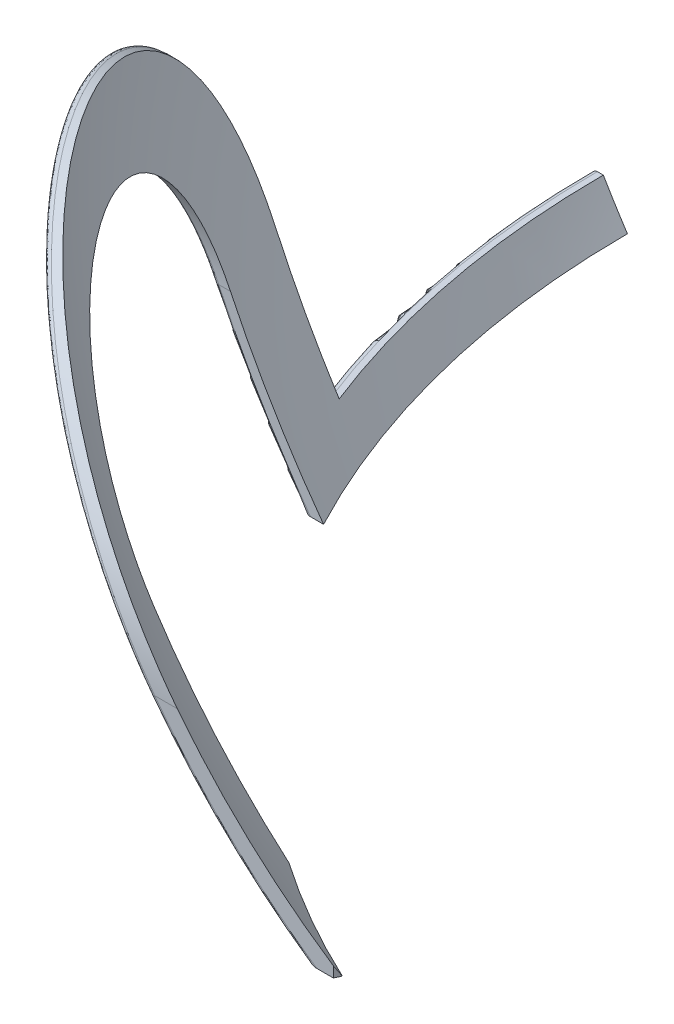
from build123d import *

# Parameters (mm, degrees)
REVOLVE1_ANGLE     = 130
SKETCH2_W          = 99.06
SKETCH2_H          = 9.525
CUT_EXTRUDE1_DEPTH = 340.527915992
FILLET1_R          = 1.27


with BuildPart() as part:
    # Sketch1 → Revolve1 (revolve, symmetric)
    with BuildSketch(Plane.XY) as revolve1_sk:
        with BuildLine():
            Line((-194.945, -11.795080514), (-198.72613444, -11.795080514))
            ThreePointArc((-198.72613444, -11.795080514), (-221.981484738, 33.976287639), (-235.681647174, 83.454919486))
            Line((-235.681647174, 83.454919486), (-232.45953717, 83.454919486))
            ThreePointArc((-232.45953717, 83.454919486), (-218.550660927, 33.920363635), (-194.945, -11.795080514))
        make_face()
    revolve(axis=Axis((17.78, 127, 0), (0, 1, 0)), revolution_arc=REVOLVE1_ANGLE / 2)
    revolve(revolve1_sk.sketch, axis=Axis((17.78, 127, 0), (0, -1, 0)), revolution_arc=REVOLVE1_ANGLE / 2)

    # Sketch2 → Cut-Extrude1 (cut, through all)
    with BuildSketch(Plane(origin=(0, 0, 0), x_dir=(0, 0, -1), z_dir=(1, 0, 0))):
        with BuildLine():
            Line((194.31, 26.304919486), (194.31, -11.795080514))
            Line((194.31, -11.795080514), (196.221195584, -11.795080514))
            add(Edge.make_bspline(
                [(196.221195584, -11.795080514), (221.715706378, 32.084968528), (229.714264549, 83.454919486)],
                knots=[4.142318737, 4.142318737, 4.142318737, 4.542248488, 4.542248488, 4.542248488], degree=2, weights=[1, 0.980073555, 1]))
            Line((229.714264549, 83.454919486), (137.160000039, 83.454919486))
            ThreePointArc((137.160000039, 83.454919486), (177.571152559, 66.716072016), (194.31, 26.304919486))
        make_face()
        with BuildLine():
            Line((0, -2.270080514), (80.01, -2.270080514))
            Line((80.01, -2.270080514), (80.01, 26.304919486))
            ThreePointArc((80.01, 26.304919486), (96.748847469, 66.716072044), (137.160000039, 83.454919486))
            Line((137.160000039, 83.454919486), (0, 83.454919486))
            Line((0, 83.454919486), (0, -2.270080514))
        make_face()
        with BuildLine():
            Line((-99.06, -2.270080514), (0, -2.270080514))
            Line((0, -2.270080514), (0, 83.454919486))
            Line((0, 83.454919486), (-229.714264549, 83.454919486))
            add(Edge.make_bspline(
                [(-229.714264549, 83.454919486), (-221.715706378, 32.084968528), (-196.221195584, -11.795080514)],
                knots=[1.740936819, 1.740936819, 1.740936819, 2.14086657, 2.14086657, 2.14086657], degree=2, weights=[1, 0.980073555, 1]))
            Line((-196.221195584, -11.795080514), (-175.26, -11.795080514))
            Line((-175.26, -11.795080514), (-175.26, 26.304919486))
            ThreePointArc((-175.26, 26.304919486), (-137.16, 64.404919486), (-99.06, 26.304919486))
            Line((-99.06, 26.304919486), (-99.06, -2.270080514))
        make_face()
        with Locations((-49.53, -7.032580514)):
            Rectangle(SKETCH2_W, SKETCH2_H)
        with BuildLine():
            Line((-175.26, -11.795080514), (-99.06, -11.795080514))
            Line((-99.06, -11.795080514), (-99.06, -2.270080514))
            Line((-99.06, -2.270080514), (-99.06, 26.304919486))
            ThreePointArc((-99.06, 26.304919486), (-137.16, 64.404919486), (-175.26, 26.304919486))
            Line((-175.26, 26.304919486), (-175.26, -11.795080514))
        make_face()
        with BuildLine():
            ThreePointArc((175.26, 26.304919486), (137.16, 64.404919486), (99.06, 26.304919486))
            Line((99.06, 26.304919486), (99.06, -11.795080514))
            Line((99.06, -11.795080514), (175.26, -11.795080514))
            Line((175.26, -11.795080514), (175.26, 26.304919486))
        make_face()
    extrude(amount=-CUT_EXTRUDE1_DEPTH, mode=Mode.SUBTRACT)

    # Fillet1
    fillet1_edges = [part.edges().sort_by_distance(p)[0] for p in [
        (-188.406041829, 82.575236344, -147.14869063),
        (-99.062434014, 5.630934177, -194.31),
        (-200.788877571, -2.270080514, -40.692415337),
        (-197.761268455, 11.763972136, -80.01),
        (-186.468133143, 63.955709956, -142.993350279),
        (-126.545268016, 6.197971718, -175.26),
        (-186.82161556, 6.732481794, -99.06),
    ]]
    fillet(fillet1_edges, radius=FILLET1_R)


with BuildPart() as body_2:
    # Mirror1: mirrored copy
    add(part.part.mirror(Plane(origin=(-235.681647174, 0, 0), x_dir=(1, 0, 0), z_dir=(0, 0, -1))))


solid = body_2.part
